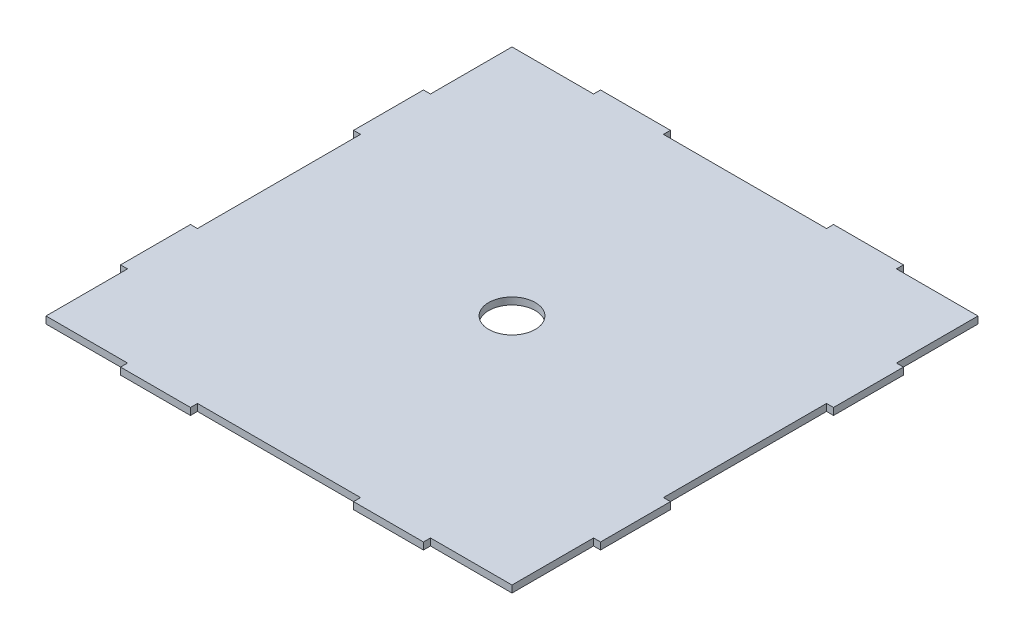
from build123d import *

# Parameters (mm, degrees)
SKETCH1_W           = 200
SKETCH1_H           = 200
BOSS_EXTRUDE1_DEPTH = 3
SKETCH2_R           = 10
CUT_EXTRUDE1_DEPTH  = 10
SKETCH3_W           = 3
SKETCH3_H           = 30
SKETCH3_W_2         = 30
SKETCH3_H_2         = 3
BOSS_EXTRUDE2_DEPTH = 3


with BuildPart() as part:
    # Sketch1 → Boss-Extrude1 (new body)
    with BuildSketch(Plane(origin=(0, 0, 0), x_dir=(1, 0, 0), z_dir=(0, 1, 0))):
        Rectangle(SKETCH1_W, SKETCH1_H)
    extrude(amount=BOSS_EXTRUDE1_DEPTH)

    # Sketch2 → Cut-Extrude1 (cut)
    with BuildSketch(Plane(origin=(0, 3, 0), x_dir=(1, 0, 0), z_dir=(0, 1, 0))):
        with Locations(Location((0, 0, 0), (0, 0, 270))):
            Circle(SKETCH2_R)
    extrude(amount=-CUT_EXTRUDE1_DEPTH, mode=Mode.SUBTRACT)

    # Sketch3 → Boss-Extrude2 (add)
    with BuildSketch(Plane(origin=(0, 3, 0), x_dir=(1, 0, 0), z_dir=(0, 1, 0))):
        with Locations((101.5, 50)):
            Rectangle(SKETCH3_W, SKETCH3_H)
        with Locations((101.5, -50)):
            Rectangle(SKETCH3_W, SKETCH3_H)
        with Locations((50, -101.5)):
            Rectangle(SKETCH3_W_2, SKETCH3_H_2)
        with Locations((-50, -101.5)):
            Rectangle(SKETCH3_W_2, SKETCH3_H_2)
        with Locations((-101.5, -50)):
            Rectangle(SKETCH3_W, SKETCH3_H)
        with Locations((-101.5, 50)):
            Rectangle(SKETCH3_W, SKETCH3_H)
        with Locations((-50, 101.5)):
            Rectangle(SKETCH3_W_2, SKETCH3_H_2)
        with Locations((50, 101.5)):
            Rectangle(SKETCH3_W_2, SKETCH3_H_2)
    extrude(amount=-BOSS_EXTRUDE2_DEPTH)


solid = part.part
